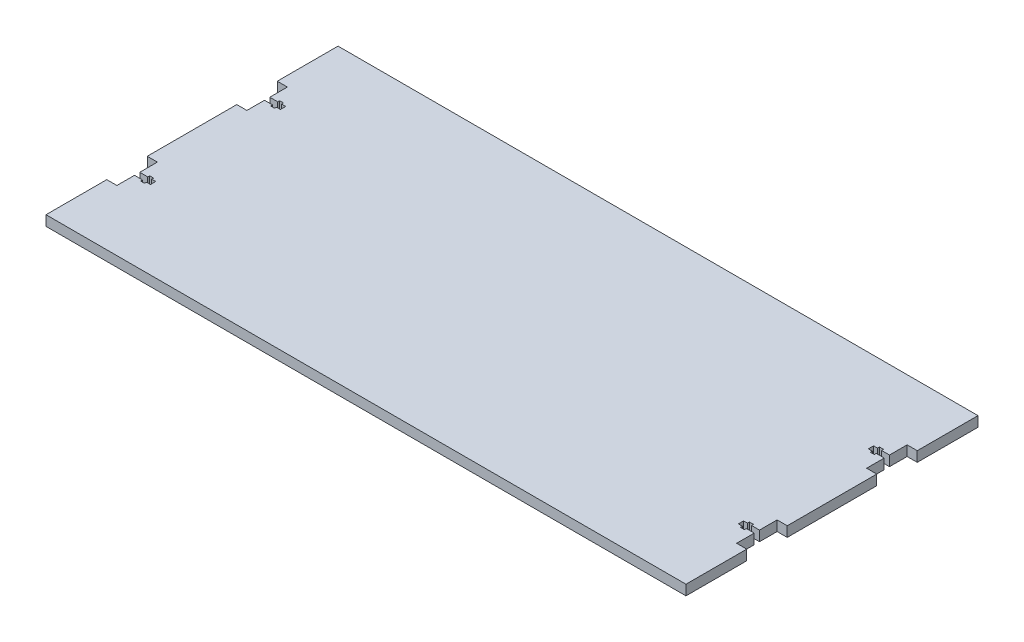
from build123d import *

# Parameters (mm, degrees)
BOSS_EXTRUDE1_DEPTH = 6.35


with BuildPart() as part:
    # Sketch1 → Boss-Extrude1 (new body)
    with BuildSketch(Plane.XZ.offset(-365.1)):
        Polygon((-388.62, -123.411863322), (-382.27, -123.411863322), (-382.27, -134.461863322), (-377.27, -134.461863322), (-377.27, -133.261863322), (-374.77, -133.261863322), (-374.77, -134.461863322), (-372.27, -134.461863322), (-372.27, -137.761863322), (-374.77, -137.761863322), (-374.77, -138.961863322), (-377.27, -138.961863322), (-377.27, -137.761863322), (-382.27, -137.761863322), (-382.27, -148.811863322), (-388.62, -148.811863322), (-388.62, -186.911863322), (12.7, -186.911863322), (12.7, -148.811863322), (6.35, -148.811863322), (6.35, -137.761863322), (1.35, -137.761863322), (1.35, -138.961863322), (-1.15, -138.961863322), (-1.15, -137.761863322), (-3.65, -137.761863322), (-3.65, -134.461863322), (-1.15, -134.461863322), (-1.15, -133.261863322), (1.35, -133.261863322), (1.35, -134.461863322), (6.35, -134.461863322), (6.35, -123.411863322), (12.7, -123.411863322), (12.7, -67.288281448), (6.35, -67.288281448), (6.35, -56.238281448), (1.35, -56.238281448), (1.35, -57.438281448), (-1.15, -57.438281448), (-1.15, -56.238281448), (-3.65, -56.238281448), (-3.65, -52.938281448), (-1.15, -52.938281448), (-1.15, -51.738281448), (1.35, -51.738281448), (1.35, -52.938281448), (6.35, -52.938281448), (6.35, -41.888281448), (12.7, -41.888281448), (12.7, -3.788281448), (-388.62, -3.788281448), (-388.62, -41.888281448), (-382.27, -41.888281448), (-382.27, -52.938281448), (-377.27, -52.938281448), (-377.27, -51.738281448), (-374.77, -51.738281448), (-374.77, -52.938281448), (-372.27, -52.938281448), (-372.27, -56.238281448), (-374.77, -56.238281448), (-374.77, -57.438281448), (-377.27, -57.438281448), (-377.27, -56.238281448), (-382.27, -56.238281448), (-382.27, -67.288281448), (-388.62, -67.288281448), align=None)
    extrude(amount=-BOSS_EXTRUDE1_DEPTH)


solid = part.part
